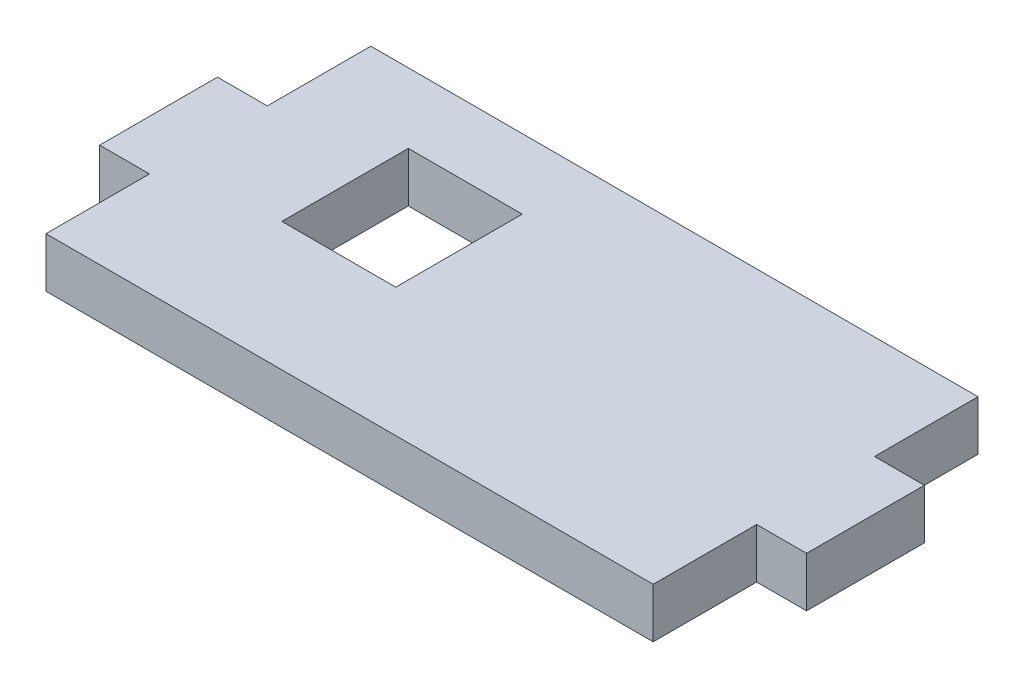
from build123d import *

# Parameters (mm, degrees)
SKETCH1_W           = 90
SKETCH1_H           = 41.35
BOSS_EXTRUDE1_DEPTH = 3.175
SKETCH3_W           = 6.35
SKETCH3_H           = 13.175
LEFTRIGHT_DEPTH     = 50.927729019
SKETCH4_W           = 14.5
SKETCH4_H           = 16.1
RIGHT_DEPTH         = 50.927729019


with BuildPart() as part:
    # Sketch1 → Boss-Extrude1 (new, symmetric)
    with BuildSketch(Plane(origin=(0, 0, 0), x_dir=(1, 0, 0), z_dir=(0, 1, 0))):
        Rectangle(SKETCH1_W, SKETCH1_H)
    extrude(amount=BOSS_EXTRUDE1_DEPTH, both=True)

    # Sketch3 → LeftRight (cut, through all)
    with BuildSketch(Plane(origin=(0, 3.175, 0), x_dir=(1, 0, 0), z_dir=(0, 1, 0))):
        with Locations((-41.825, -14.0875)):
            Rectangle(SKETCH3_W, SKETCH3_H)
        with Locations((-41.825, 14.0875)):
            Rectangle(SKETCH3_W, SKETCH3_H)
        with Locations((41.825, 14.0875)):
            Rectangle(SKETCH3_W, SKETCH3_H)
        with Locations((41.825, -14.0875)):
            Rectangle(SKETCH3_W, SKETCH3_H)
    extrude(amount=-LEFTRIGHT_DEPTH, mode=Mode.SUBTRACT)

    # Sketch4 → Right (cut, through all)
    with BuildSketch(Plane.XZ.offset(3.175)):
        with Locations((-17.74, -3.742440275)):
            Rectangle(SKETCH4_W, SKETCH4_H)
    extrude(amount=-RIGHT_DEPTH, mode=Mode.SUBTRACT)


solid = part.part
